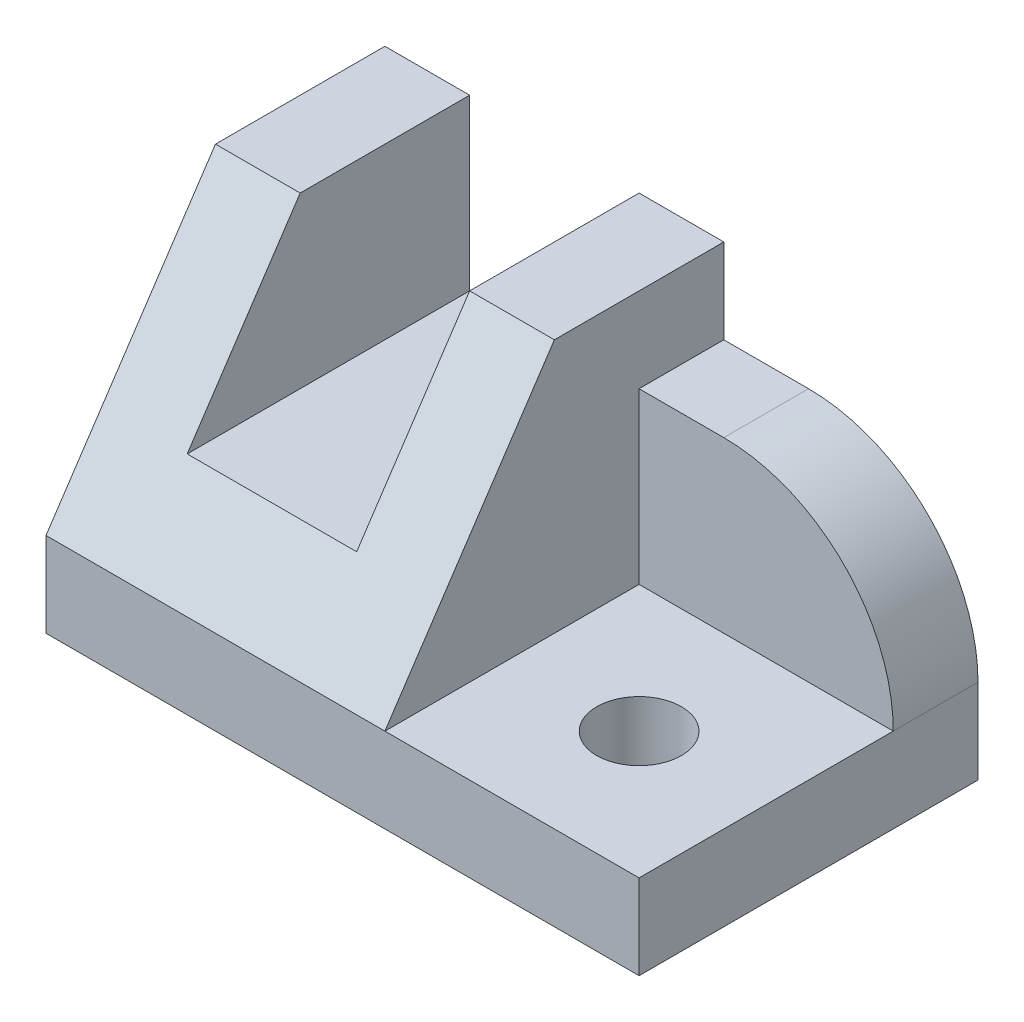
from build123d import *

# Parameters (mm, degrees)
SKETCH1_W           = 70
SKETCH1_H           = 40
BOSS_EXTRUDE1_DEPTH = 10
CUT_EXTRUDE1_REACH  = 43.533
SKETCH2_R           = 5
BOSS_EXTRUDE2_DEPTH = 40
CUT_EXTRUDE2_REACH  = 68.521
SKETCH5_W           = 20
SKETCH5_H           = 20
BOSS_EXTRUDE3_DEPTH = 10


with BuildPart() as part:
    # Sketch1 → Boss-Extrude1 (new body)
    with BuildSketch(Plane(origin=(0, 0, 0), x_dir=(1, 0, 0), z_dir=(0, 1, 0))):
        Rectangle(SKETCH1_W, SKETCH1_H)
    extrude(amount=BOSS_EXTRUDE1_DEPTH)

    # Sketch2 → Cut-Extrude1 (cut, up to next)
    with BuildSketch(Plane(origin=(0, 10, 0), x_dir=(1, 0, 0), z_dir=(0, 1, 0)), mode=Mode.PRIVATE) as cut_extrude1_sk1:
        with Locations((20, -5)):
            Circle(SKETCH2_R)
    cut_extrude1_tool1 = extrude(cut_extrude1_sk1.sketch, amount=-CUT_EXTRUDE1_REACH, mode=Mode.PRIVATE) & part.part
    add(cut_extrude1_tool1.solids().sort_by_distance((20, 10, 5))[0], mode=Mode.SUBTRACT)

    # Sketch3 → Boss-Extrude2 (add)
    with BuildSketch(Plane.ZY.offset(35)):
        Polygon((0, 40), (-20, 40), (-20, 10), (20, 10), align=None)
    extrude(amount=-BOSS_EXTRUDE2_DEPTH)

    # Sketch5 → Cut-Extrude2 (cut, up to next)
    with BuildSketch(Plane(origin=(0, 0, -20), x_dir=(-1, 0, 0), z_dir=(0, 0, -1)), mode=Mode.PRIVATE) as cut_extrude2_sk1:
        with Locations((15, 30)):
            Rectangle(SKETCH5_W, SKETCH5_H)
    cut_extrude2_tool1 = extrude(cut_extrude2_sk1.sketch, amount=-CUT_EXTRUDE2_REACH, mode=Mode.PRIVATE) & part.part
    add(cut_extrude2_tool1.solids().sort_by_distance((-15, 30, -20))[0], mode=Mode.SUBTRACT)

    # Sketch6 → Boss-Extrude3 (add)
    with BuildSketch(Plane(origin=(0, 0, -20), x_dir=(-1, 0, 0), z_dir=(0, 0, -1))):
        with BuildLine():
            Line((-5, 10), (-35, 10))
            ThreePointArc((-35, 10), (-29.142135624, 24.142135624), (-15, 30))
            Line((-15, 30), (-5, 30))
            Line((-5, 30), (-5, 10))
        make_face()
    extrude(amount=-BOSS_EXTRUDE3_DEPTH)


solid = part.part
